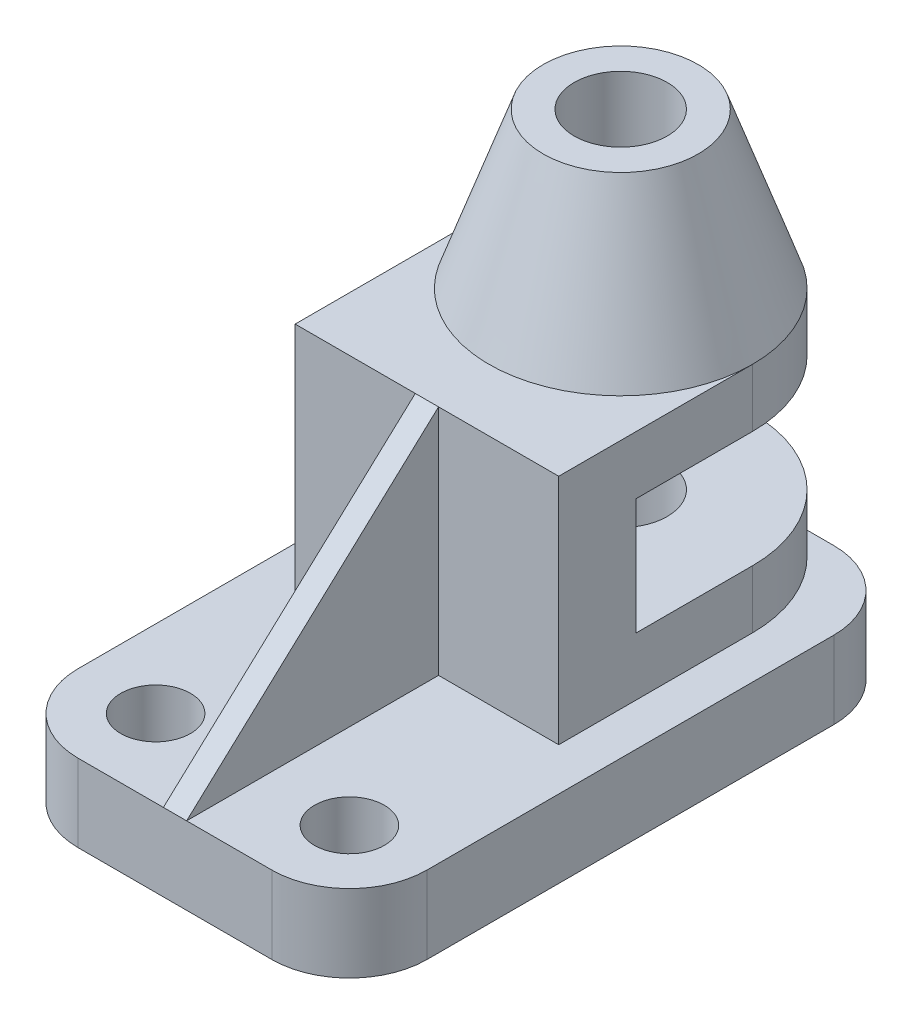
from build123d import *

# Parameters (mm, degrees)
SKETCH2_W           = 90
SKETCH2_H           = 145
SKETCH2_R           = 9
BOSS_EXTRUDE2_DEPTH = 20
FILLET1_R           = 20
FILLET2_R           = 20
BOSS_EXTRUDE3_DEPTH = 60
SKETCH4_W           = 83.251362913
SKETCH4_H           = 30
CUT_EXTRUDE1_DEPTH  = 136.98988933
SKETCH5_R           = 34
SKETCH6_R           = 20
SKETCH6_3_R         = 12
CUT_EXTRUDE2_DEPTH  = 150.255653211
RIB2_REACH          = 151.256
SKETCH9_WALL_W      = 388.970336646
SKETCH9_WALL_H      = 6


with BuildPart() as part:
    # Sketch2 → Boss-Extrude2 (new body)
    with BuildSketch(Plane(origin=(0, 0, 0), x_dir=(1, 0, 0), z_dir=(0, 1, 0))):
        Rectangle(SKETCH2_W, SKETCH2_H)
        with Locations(Location((-25, -52.5, 0), (0, 0, 270))):
            Circle(SKETCH2_R, mode=Mode.SUBTRACT)
        with Locations(Location((25, -52.5, 0), (0, 0, 270))):
            Circle(SKETCH2_R, mode=Mode.SUBTRACT)
    extrude(amount=BOSS_EXTRUDE2_DEPTH)

    # Fillet1
    fillet1_edges = [part.edges().sort_by_distance(p)[0] for p in [
        (45, 10, 72.5),
        (-45, 10, 72.5),
    ]]
    fillet(fillet1_edges, radius=FILLET1_R)

    # Fillet2
    fillet2_edges = [part.edges().sort_by_distance(p)[0] for p in [
        (-45, 10, -72.5),
        (45, 10, -72.5),
    ]]
    fillet(fillet2_edges, radius=FILLET2_R)

    # Sketch3 → Boss-Extrude3 (add)
    with BuildSketch(Plane(origin=(0, 20, 0), x_dir=(1, 0, 0), z_dir=(0, 1, 0))):
        with BuildLine():
            Line((-34, -7.5), (34, -7.5))
            Line((34, -7.5), (34, 42.5))
            ThreePointArc((34, 42.5), (0, 76.5), (-34, 42.5))
            Line((-34, 42.5), (-34, -7.5))
        make_face()
    extrude(amount=BOSS_EXTRUDE3_DEPTH)

    # Sketch4 → Cut-Extrude1 (cut, through all)
    with BuildSketch(Plane(origin=(34, 0, 0), x_dir=(0, 0, -1), z_dir=(1, 0, 0))):
        with Locations((54.125681457, 50)):
            Rectangle(SKETCH4_W, SKETCH4_H)
    extrude(amount=-CUT_EXTRUDE1_DEPTH, mode=Mode.SUBTRACT)

    # Sketch5 → Loft1 section 0
    with BuildSketch(Plane(origin=(0, 80, 0), x_dir=(1, 0, 0), z_dir=(0, 1, 0))):
        with Locations((0, 42.5)):
            Circle(SKETCH5_R)
    # Sketch6 → Loft1 section 1
    with BuildSketch(Plane(origin=(0, 120, 0), x_dir=(1, 0, 0), z_dir=(0, 1, 0))):
        with Locations((0, 42.5)):
            Circle(SKETCH6_R)
    loft()

    # Sketch6<3> → Cut-Extrude2 (cut, through all)
    with BuildSketch(Plane(origin=(0, 120, 0), x_dir=(1, 0, 0), z_dir=(0, 1, 0))):
        with Locations(Location((0, 42.5, 0), (0, 0, 270))):
            Circle(SKETCH6_3_R)
    extrude(amount=-CUT_EXTRUDE2_DEPTH, mode=Mode.SUBTRACT)

    # Sketch9 wall → Rib2 (add, up to next)
    with BuildSketch(Plane(origin=(0, 50, 40), x_dir=(0, 0.678280102733, -0.734803444627), z_dir=(0, 0.734803444627, 0.678280102733)), mode=Mode.PRIVATE) as rib2_sk1:
        Rectangle(SKETCH9_WALL_W, SKETCH9_WALL_H)
    rib2_tool1 = extrude(rib2_sk1.sketch, amount=-RIB2_REACH, mode=Mode.PRIVATE) - part.part
    add(rib2_tool1.solids().sort_by_distance((0, 50, 40))[0])


solid = part.part
